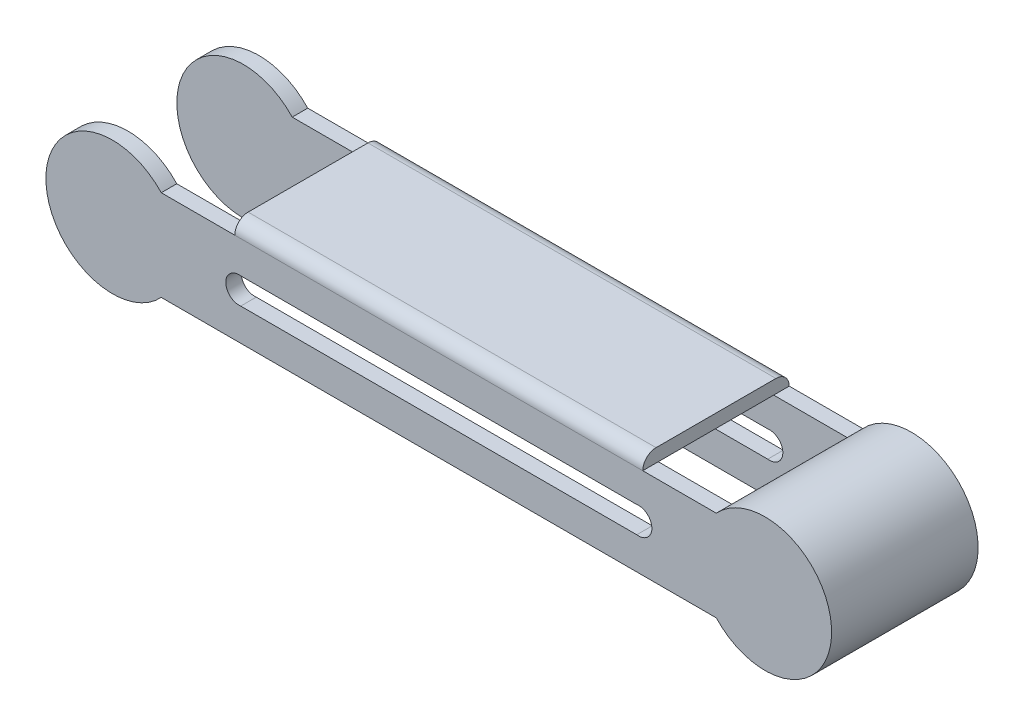
from build123d import *

# Parameters (mm, degrees)
BOSS_EXTRUDE1_DEPTH     = 33
CUT_EXTRUDE1_DEPTH      = 60
SKETCH3_W               = 125.025821482
SKETCH3_H               = 26
CUT_EXTRUDE2_DEPTH      = 25
CUT_EXTRUDE6_DEPTH      = 98.759359099
CUT_EXTRUDE6_DEPTH_BACK = 98.759359099
SKETCH7_W               = 50
SKETCH7_H               = 26
SKETCH8_W               = 91.898790586
SKETCH8_H               = 33
BOSS_EXTRUDE2_DEPTH     = 3
FILLET1_R               = 3


with BuildPart() as part:
    # Sketch1 → Boss-Extrude1 (new body)
    with BuildSketch(Plane.XY):
        with BuildLine():
            Line((-62.512910741, 10.211947396), (62.512910741, 10.211947396))
            ThreePointArc((62.512910741, 10.211947396), (88.5, 0), (62.512910741, -10.211947396))
            Line((62.512910741, -10.211947396), (-62.512910741, -10.211947396))
            ThreePointArc((-62.512910741, -10.211947396), (-88.5, 0), (-62.512910741, 10.211947396))
        make_face()
    extrude(amount=BOSS_EXTRUDE1_DEPTH)

    # Sketch2 → Cut-Extrude1 (cut)
    with BuildSketch(Plane.XY.offset(43)):
        with BuildLine():
            Line((44.606109659, 2.95), (-44.606109659, 2.95))
            ThreePointArc((-44.606109659, 2.95), (-47.976180371, 0), (-44.606109659, -2.95))
            Line((-44.606109659, -2.95), (44.606109659, -2.95))
            ThreePointArc((44.606109659, -2.95), (48.007891593, 0), (44.606109659, 2.95))
        make_face()
    extrude(amount=-CUT_EXTRUDE1_DEPTH, mode=Mode.SUBTRACT)

    # Sketch3 → Cut-Extrude2 (cut)
    with BuildSketch(Plane(origin=(0, 10.211947396, 0), x_dir=(1, 0, 0), z_dir=(0, 1, 0))):
        with Locations((0, -16.5)):
            Rectangle(SKETCH3_W, SKETCH3_H)
    extrude(amount=-CUT_EXTRUDE2_DEPTH, mode=Mode.SUBTRACT)

    # Sketch7 → Cut-Extrude6 (cut, two sides: drawn at the far end of the back side and taken through both)
    with BuildSketch(Plane(origin=(0, 10.211947396, 0), x_dir=(-1, 0, 0), z_dir=(0, -1, 0)).offset(-CUT_EXTRUDE6_DEPTH_BACK)):
        with Locations((87.512910741, -16.5)):
            Rectangle(SKETCH7_W, SKETCH7_H)
    extrude(amount=CUT_EXTRUDE6_DEPTH + CUT_EXTRUDE6_DEPTH_BACK, mode=Mode.SUBTRACT)

    # Sketch8 → Boss-Extrude2 (add)
    with BuildSketch(Plane(origin=(0, 10.211947396, 0), x_dir=(1, 0, 0), z_dir=(0, 1, 0))):
        with Locations((0, -16.5)):
            Rectangle(SKETCH8_W, SKETCH8_H)
    extrude(amount=BOSS_EXTRUDE2_DEPTH)

    # Fillet1
    fillet1_edges = [part.edges().sort_by_distance(p)[0] for p in [
        (0, 13.211947396, 0),
        (0, 13.211947396, 33),
    ]]
    fillet(fillet1_edges, radius=FILLET1_R)


solid = part.part
